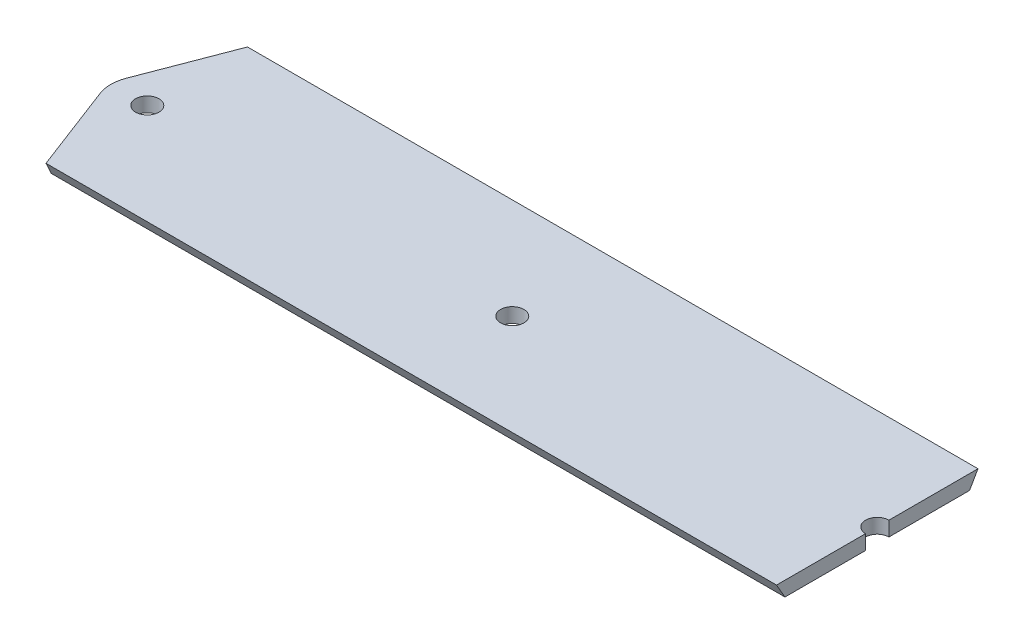
from build123d import *

# Parameters (mm, degrees)
SKETCH_1_R          = 1.6
EXTRUDE_1_DEPTH     = 2
CUT_EXTRUDE_1_DEPTH = 106.948100502


with BuildPart() as part:
    # Эскиз1 → Бобышка-Вытянуть1 (new body)
    with BuildSketch(Plane(origin=(0, 0, 0), x_dir=(1, 0, 0), z_dir=(0, 1, 0))):
        with BuildLine():
            Line((50, -14), (50, -1.6))
            ThreePointArc((50, -1.6), (48.4, 0), (50, 1.6))
            Line((50, 1.6), (50, 14))
            Line((50, 14), (-50, 14))
            Line((-50, 14), (-54.670248868, 1.785714286))
            ThreePointArc((-54.670248868, 1.785714286), (-55, 0), (-54.670248868, -1.785714286))
            Line((-54.670248868, -1.785714286), (-50, -14))
            Line((-50, -14), (50, -14))
        make_face()
        with Locations(Location((-50, 0, 0), (0, 0, 270))):
            Circle(SKETCH_1_R, mode=Mode.SUBTRACT)
        with Locations(Location((0, 0, 0), (0, 0, 270))):
            Circle(SKETCH_1_R, mode=Mode.SUBTRACT)
    extrude(amount=EXTRUDE_1_DEPTH)

    # Эскиз2 → Вырез-Вытянуть1 (cut, through all)
    with BuildSketch(Plane.ZY.offset(55)):
        Polygon((-14, 0), (-12.645299462, 0), (-13.8, 2), (-14, 2), align=None)
        Polygon((14, 2), (14, 0), (12.645299462, 0), (13.8, 2), align=None)
    extrude(amount=-CUT_EXTRUDE_1_DEPTH, mode=Mode.SUBTRACT)


solid = part.part
